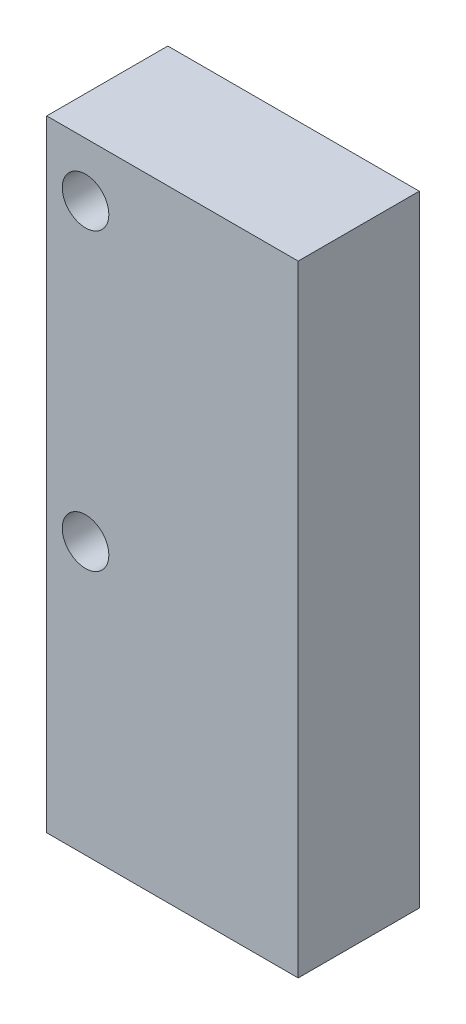
from build123d import *

# Parameters (mm, degrees)
SKETCH1_W           = 16.2
SKETCH1_H           = 40
BOSS_EXTRUDE1_DEPTH = 7.8
SKETCH2_R           = 1.5
CUT_EXTRUDE1_DEPTH  = 23.944498251


with BuildPart() as part:
    # Sketch1 → Boss-Extrude1 (new body)
    with BuildSketch(Plane.XY):
        Rectangle(SKETCH1_W, SKETCH1_H)
    extrude(amount=BOSS_EXTRUDE1_DEPTH)

    # Sketch2 → Cut-Extrude1 (cut, through all)
    with BuildSketch(Plane.XY.offset(7.8)):
        with Locations((-5.6, 16.5)):
            Circle(SKETCH2_R)
        with Locations((-5.6, -2.5)):
            Circle(SKETCH2_R)
    extrude(amount=-CUT_EXTRUDE1_DEPTH, mode=Mode.SUBTRACT)


solid = part.part
